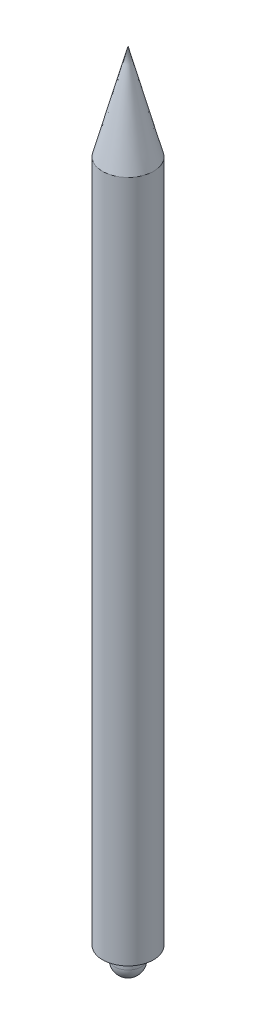
from build123d import *

# Parameters (mm, degrees)
SKETCH1_R           = 4.25
BOSS_EXTRUDE1_DEPTH = 114


with BuildPart() as part:
    # Sketch1 → Boss-Extrude1 (new body)
    with BuildSketch(Plane(origin=(0, 0, 0), x_dir=(1, 0, 0), z_dir=(0, 1, 0))):
        with Locations(Location((0, 0, 0), (0, 0, 90))):
            Circle(SKETCH1_R)
    extrude(amount=BOSS_EXTRUDE1_DEPTH)

    # Sketch2 → Revolve1 (revolve)
    with BuildSketch(Plane.XY, mode=Mode.PRIVATE) as revolve1_sk:
        with BuildLine():
            Line((2.25, 0), (2.25, -2))
            ThreePointArc((2.25, -2), (1.590990258, -3.590990258), (0, -4.25))
            Line((0, -4.25), (0, 0))
            Line((0, 0), (2.25, 0))
        make_face()
    revolve(revolve1_sk.sketch.rotate(Axis((0, 0, 0), (0, -1, 0)), 180), axis=Axis((0, 0, 0), (0, -1, 0)))

    # Sketch3 → Revolve2 (revolve)
    with BuildSketch(Plane.XY, mode=Mode.PRIVATE) as revolve2_sk:
        Polygon((0, 114), (0, 130), (4.25, 114), align=None)
    revolve(revolve2_sk.sketch.rotate(Axis((0, 114, 0), (0, 1, 0)), 90), axis=Axis((0, 114, 0), (0, 1, 0)))


solid = part.part
